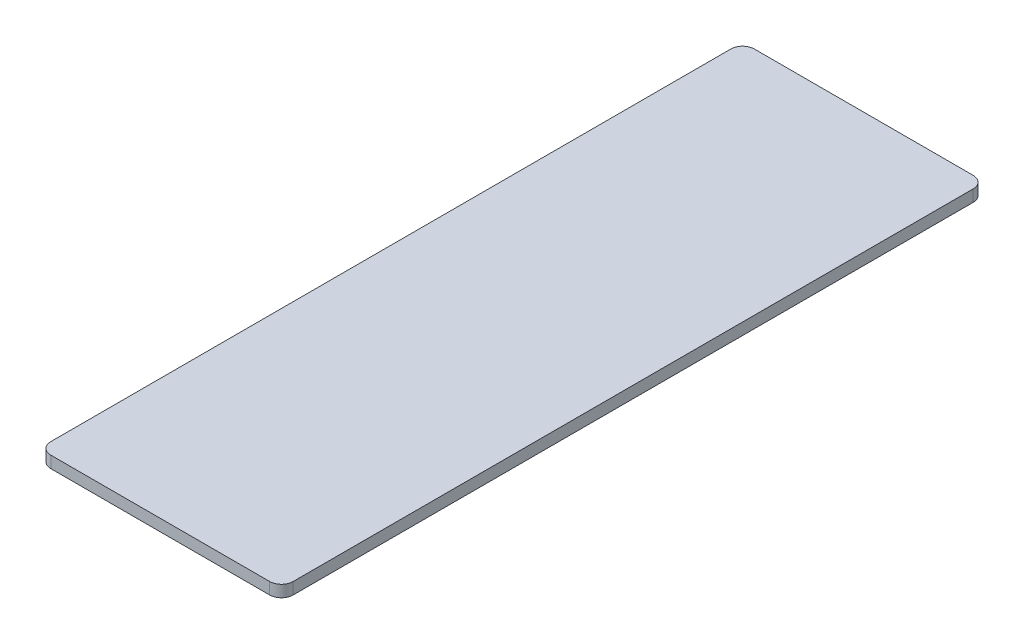
from build123d import *

# Parameters (mm, degrees)
SPINE_BODY_DEPTH = 1.5


with BuildPart() as part:
    # Sketch1 → Spine_Body (new, symmetric)
    with BuildSketch(Plane(origin=(0, 0, 0), x_dir=(1, 0, 0), z_dir=(0, 1, 0))):
        with BuildLine():
            Line((-28, 90), (28, 90))
            ThreePointArc((28, 90), (30.121320344, 89.121320344), (31, 87))
            Line((31, 87), (31, -87))
            ThreePointArc((31, -87), (30.121320344, -89.121320344), (28, -90))
            Line((28, -90), (-28, -90))
            ThreePointArc((-28, -90), (-30.121320344, -89.121320344), (-31, -87))
            Line((-31, -87), (-31, 87))
            ThreePointArc((-31, 87), (-30.121320344, 89.121320344), (-28, 90))
        make_face()
    extrude(amount=SPINE_BODY_DEPTH, both=True)


solid = part.part
